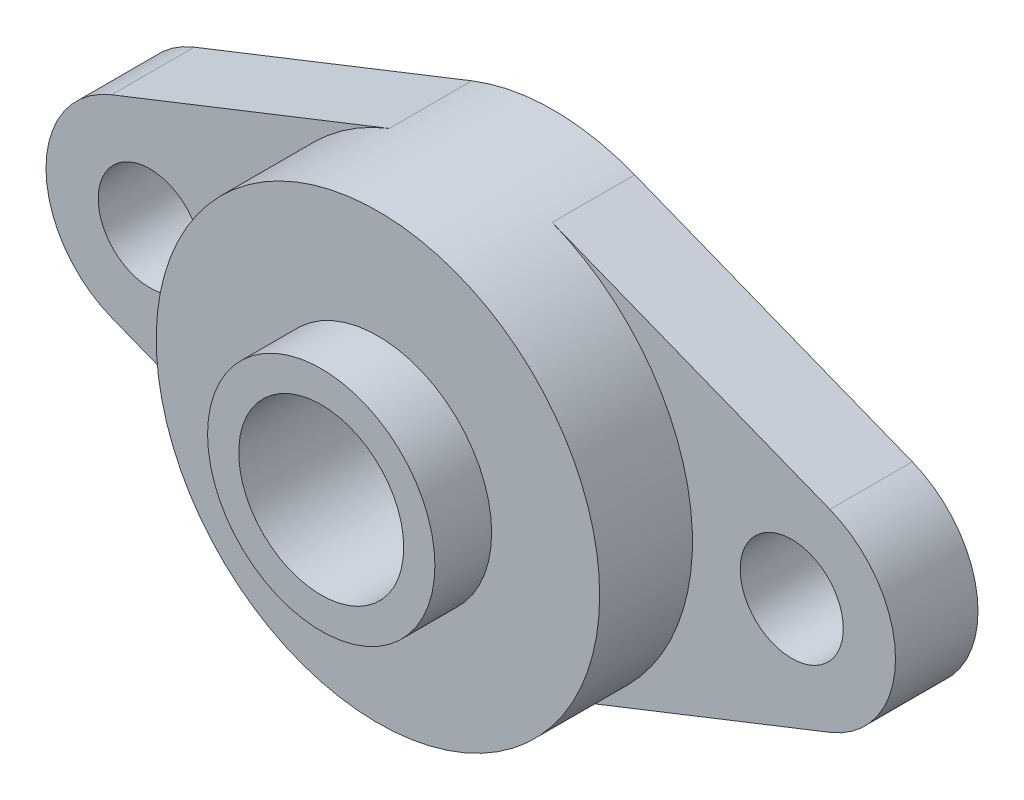
from build123d import *

# Parameters (mm, degrees)
SKETCH2_R           = 7.9375
SKETCH2_R_2         = 12.7
BOSS_EXTRUDE1_DEPTH = 6.35
BOSS_EXTRUDE2_START = 14.2875
SKETCH3_R           = 12.7
BOSS_EXTRUDE2_DEPTH = 14.2875
SKETCH4_R           = 17.5
SKETCH4_R_2         = 12.7
BOSS_EXTRUDE3_DEPTH = 8.73125


with BuildPart() as part:
    # Sketch2 → Boss-Extrude1 (new, symmetric)
    with BuildSketch(Plane.XY):
        with BuildLine():
            Line((-12.540060904, 31.744119126), (-55.281118751, 14.859874633))
            ThreePointArc((-55.281118751, 14.859874633), (-65.388262121, 0), (-55.281118751, -14.859874633))
            Line((-55.281118751, -14.859874633), (-12.540060904, -31.744119126))
            ThreePointArc((-12.540060904, -31.744119126), (0, -34.13125), (12.540060904, -31.744119126))
            Line((12.540060904, -31.744119126), (55.281118751, -14.859874633))
            ThreePointArc((55.281118751, -14.859874633), (65.388262121, 0), (55.281118751, 14.859874633))
            Line((55.281118751, 14.859874633), (12.540060904, 31.744119126))
            ThreePointArc((12.540060904, 31.744119126), (0, 34.13125), (-12.540060904, 31.744119126))
        make_face()
        with Locations((-49.4109375, 0)):
            Circle(SKETCH2_R, mode=Mode.SUBTRACT)
        Circle(SKETCH2_R_2, mode=Mode.SUBTRACT)
        with Locations((49.4109375, 0)):
            Circle(SKETCH2_R, mode=Mode.SUBTRACT)
    extrude(amount=BOSS_EXTRUDE1_DEPTH, both=True)

    # Sketch3 → Boss-Extrude2 (add)
    with BuildSketch(Plane.XY.offset(6.35).offset(BOSS_EXTRUDE2_START)):
        with BuildLine():
            ThreePointArc((-12.540060904, 31.744119126), (-19.195497816, -28.221890265), (34.13125, 0))
            ThreePointArc((34.13125, 0), (28.221890265, 19.195497816), (12.540060904, 31.744119126))
            ThreePointArc((12.540060904, 31.744119126), (0, 34.13125), (-12.540060904, 31.744119126))
        make_face()
        Circle(SKETCH3_R, mode=Mode.SUBTRACT)
    extrude(amount=-BOSS_EXTRUDE2_DEPTH)

    # Sketch4 → Boss-Extrude3 (add)
    with BuildSketch(Plane.XY.offset(20.6375)):
        Circle(SKETCH4_R)
        Circle(SKETCH4_R_2, mode=Mode.SUBTRACT)
    extrude(amount=BOSS_EXTRUDE3_DEPTH)


solid = part.part
